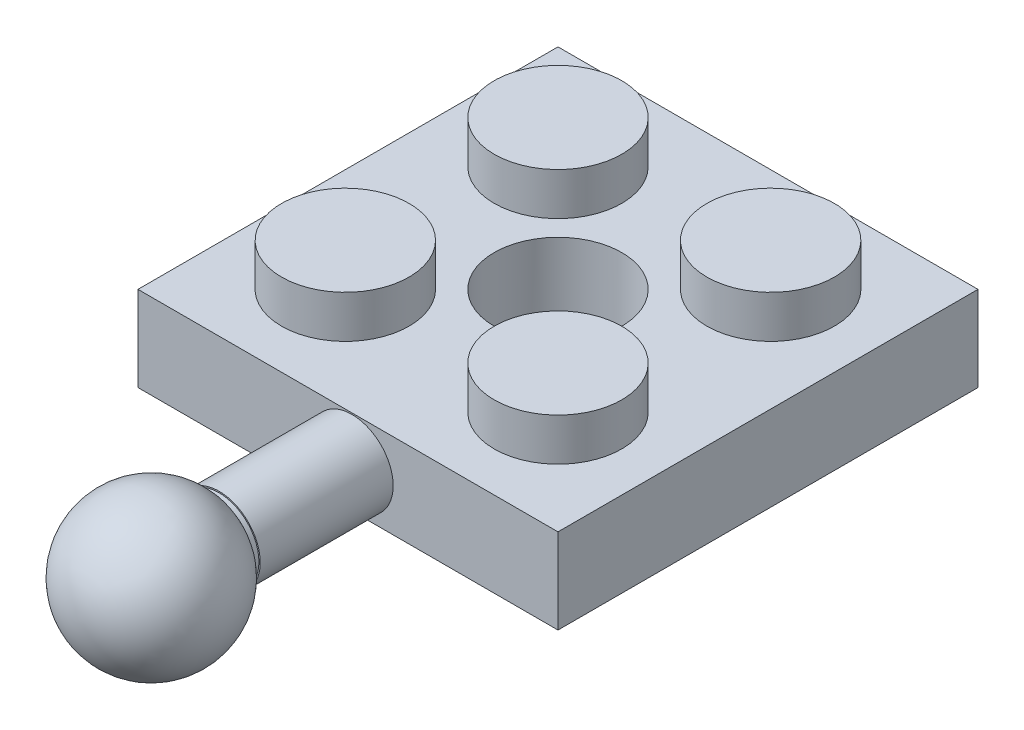
from build123d import *

# Parameters (mm, degrees)
SKETCH1_W            = 15.8
SKETCH1_H            = 3.2
BOSS_EXTRUDE1_DEPTH  = 15.8
SKETCH2_R            = 2.4
BOSS_EXTRUDE2_DEPTH  = 1.6
LPATTERN1_COUNT      = 2
LPATTERN1_PITCH      = 8
LPATTERN1_COUNT_DIR2 = 4
LPATTERN1_PITCH_DIR2 = 8
SHELL1_T             = -1.2
SKETCH4_R            = 3.25
SKETCH4_R_2          = 2.4
BOSS_EXTRUDE3_DEPTH  = 1.8
SKETCH6_R            = 2.4
CUT_EXTRUDE1_DEPTH   = 23.519325034
SKETCH11_R           = 1.55
BOSS_EXTRUDE5_DEPTH  = 5
BOSS_EXTRUDE7_REACH  = 28.558
SKETCH14_R           = 1.5


with BuildPart() as part:
    # Sketch1 → Boss-Extrude1 (new body)
    with BuildSketch(Plane.XY):
        with Locations((7.9, 1.6)):
            Rectangle(SKETCH1_W, SKETCH1_H)
    extrude(amount=-BOSS_EXTRUDE1_DEPTH)

    # Sketch2 → Boss-Extrude2 (add)
    with BuildSketch(Plane(origin=(0, 3.2, 0), x_dir=(1, 0, 0), z_dir=(0, 1, 0))):
        with Locations(Location((3.9, 3.9, 0), (0, 0, 270))):
            Circle(SKETCH2_R)
    boss_extrude2 = extrude(amount=BOSS_EXTRUDE2_DEPTH)

    # LPattern1: Boss-Extrude2 2 × 4, 4 skipped
    with Locations(*[(j * LPATTERN1_PITCH_DIR2, 0, -i * LPATTERN1_PITCH) for i in range(LPATTERN1_COUNT) for j in range(LPATTERN1_COUNT_DIR2) if (i, j) not in ((0, 0), (0, 2), (0, 3), (1, 2), (1, 3))]):
        add(boss_extrude2)

    # Shell1
    shell1_openings = [part.faces().sort_by_distance(p)[0] for p in [
        (7.9, 0, -7.9),
    ]]
    offset(amount=SHELL1_T, openings=shell1_openings, kind=Kind.INTERSECTION)

    # Sketch4 → Boss-Extrude3 (add)
    with BuildSketch(Plane.XZ.offset(-2)):
        with Locations(Location((7.9, -7.9, 0), (0, 0, 90))):
            Circle(SKETCH4_R)
        with Locations(Location((7.9, -7.9, 0), (0, 0, 270))):
            Circle(SKETCH4_R_2, mode=Mode.SUBTRACT)
    extrude(amount=BOSS_EXTRUDE3_DEPTH)

    # Sketch6 → Cut-Extrude1 (cut, through all)
    with BuildSketch(Plane.XZ.offset(-2)):
        with Locations(Location((7.9, -7.9, 0), (0, 0, 90))):
            Circle(SKETCH6_R)
    extrude(amount=-CUT_EXTRUDE1_DEPTH, mode=Mode.SUBTRACT)

    # Sketch11 → Boss-Extrude5 (add)
    with BuildSketch(Plane.XY):
        with Locations((8.05, 1.6)):
            Circle(SKETCH11_R)
    extrude(amount=BOSS_EXTRUDE5_DEPTH)


with BuildPart() as body_2:
    # Sketch12 → Revolve1 (revolve)
    with BuildSketch(Plane.XY.offset(7.55)):
        with BuildLine():
            Line((8.05, 4.4), (8.05, -1.2))
            ThreePointArc((8.05, -1.2), (5.25, 1.6), (8.05, 4.4))
        make_face()
    revolve(axis=Axis((8.05, 3.15, 7.55), (0, -1, 0)))

    # Sketch14 → Boss-Extrude7 (add, up to next)
    with BuildSketch(Plane.XY.offset(5), mode=Mode.PRIVATE) as boss_extrude7_sk1:
        with Locations((8.05, 1.6)):
            Circle(SKETCH14_R)
    boss_extrude7_tool1 = extrude(boss_extrude7_sk1.sketch, amount=BOSS_EXTRUDE7_REACH, mode=Mode.PRIVATE) - body_2.part

    add(part.part)  # Boss-Extrude7 merges part
    add(boss_extrude7_tool1.solids().sort_by_distance((8.05, 1.6, 5))[0])


solid = body_2.part
